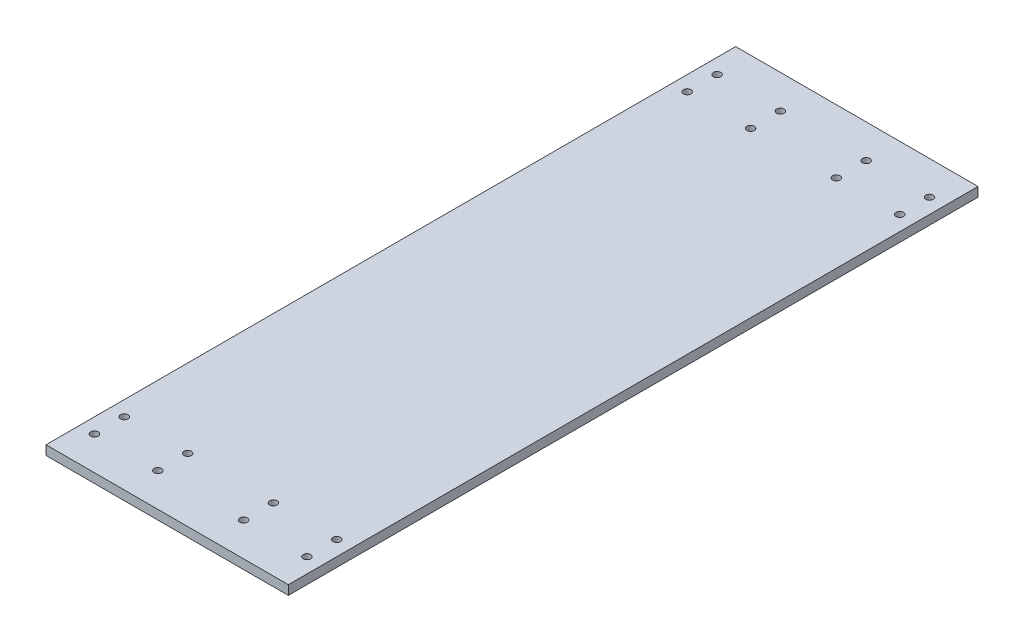
from build123d import *

# Parameters (mm, degrees)
SKETCH2_W                                  = 130
SKETCH2_H                                  = 370
BOSS_EXTRUDE1_DEPTH                        = 5
SKETCH3_R                                  = 2
CUT_EXTRUDE1_DEPTH                         = 10
MIRROR1_AT_THE_SECOND_PLANE_COPY_1_SKETC_R = 2
MIRROR1_AT_THE_SECOND_PLANE_COPY_1_DEPTH   = 10


with BuildPart() as part:
    # Sketch2 → Boss-Extrude1 (new body)
    with BuildSketch(Plane(origin=(0, 0, 0), x_dir=(1, 0, 0), z_dir=(0, 1, 0))):
        Rectangle(SKETCH2_W, SKETCH2_H)
    extrude(amount=BOSS_EXTRUDE1_DEPTH)

    # Sketch3 → Cut-Extrude1 (cut)
    with BuildSketch(Plane(origin=(0, 5, 0), x_dir=(1, 0, 0), z_dir=(0, 1, 0))):
        with Locations(Location((-57, 167, 0), (0, 0, 270))):
            Circle(SKETCH3_R)
        with Locations(Location((-57, 151, 0), (0, 0, 270))):
            Circle(SKETCH3_R)
        with Locations(Location((-23, 167, 0), (0, 0, 270))):
            Circle(SKETCH3_R)
        with Locations(Location((-23, 151, 0), (0, 0, 270))):
            Circle(SKETCH3_R)
    cut_extrude1 = extrude(amount=-CUT_EXTRUDE1_DEPTH, mode=Mode.SUBTRACT)

    # Mirror1: Cut-Extrude1 across plane
    add(cut_extrude1.mirror(Plane.XY), mode=Mode.SUBTRACT)

    # Mirror1 at the second plane: Cut-Extrude1 across plane
    add(cut_extrude1.mirror(Plane(origin=(0, 0, 0), x_dir=(0, 0, 1), z_dir=(1, 0, 0))), mode=Mode.SUBTRACT)

    # Mirror1 at the second plane copy 1 sketc → Mirror1 at the second plane copy 1 (cut)
    with BuildSketch(Plane(origin=(0, 5, 0), x_dir=(-1, 0, 0), z_dir=(0, 1, 0))):
        with Locations(Location((-57, 167, 0), (0, 0, 270))):
            Circle(MIRROR1_AT_THE_SECOND_PLANE_COPY_1_SKETC_R)
        with Locations(Location((-57, 151, 0), (0, 0, 270))):
            Circle(MIRROR1_AT_THE_SECOND_PLANE_COPY_1_SKETC_R)
        with Locations(Location((-23, 167, 0), (0, 0, 270))):
            Circle(MIRROR1_AT_THE_SECOND_PLANE_COPY_1_SKETC_R)
        with Locations(Location((-23, 151, 0), (0, 0, 270))):
            Circle(MIRROR1_AT_THE_SECOND_PLANE_COPY_1_SKETC_R)
    extrude(amount=-MIRROR1_AT_THE_SECOND_PLANE_COPY_1_DEPTH, mode=Mode.SUBTRACT)


solid = part.part
